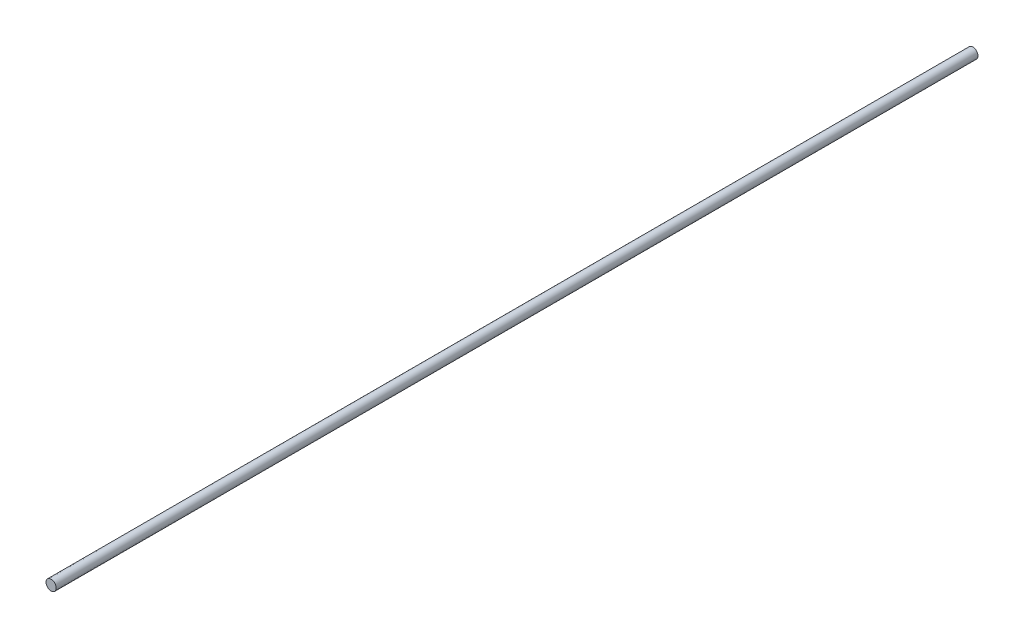
from build123d import *

# Parameters (mm, degrees)
SKETCH1_R           = 5
BOSS_EXTRUDE1_DEPTH = 450


with BuildPart() as part:
    # Sketch1 → Boss-Extrude1 (new, symmetric)
    with BuildSketch(Plane.XY):
        Circle(SKETCH1_R)
    extrude(amount=BOSS_EXTRUDE1_DEPTH, both=True)


solid = part.part
